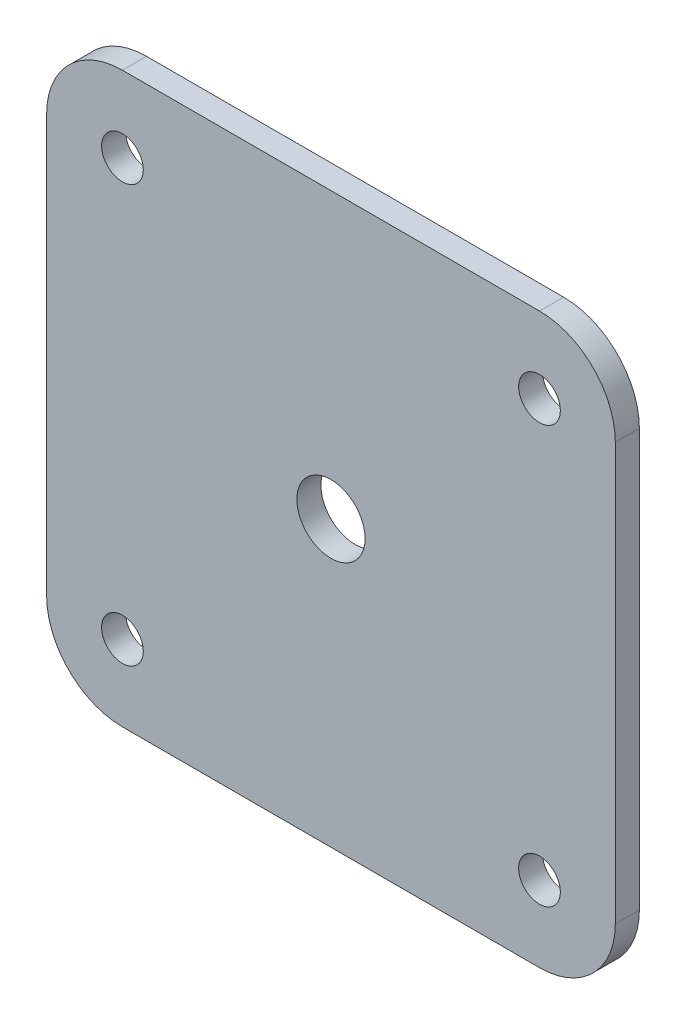
from build123d import *

# Parameters (mm, degrees)
SKETCH1_W            = 75
SKETCH1_H            = 75
BOSS_EXTRUDE1_DEPTH  = 3.175
M8_CLEARANCE_HOLE1_D = 9
M5_CLEARANCE_HOLE1_D = 5.5
FILLET1_R            = 10


with BuildPart() as part:
    # Sketch1 → Boss-Extrude1 (new body)
    with BuildSketch(Plane.XY.offset(107.95)):
        with Locations((0, 279.4)):
            Rectangle(SKETCH1_W, SKETCH1_H)
    extrude(amount=BOSS_EXTRUDE1_DEPTH)

    # M8 Clearance Hole1 (through all)
    with Locations(Plane.XY.offset(111.125)):
        with Locations((0, 279.4)):
            Hole(M8_CLEARANCE_HOLE1_D / 2)

    # M5 Clearance Hole1 (through all)
    with Locations(Plane.XY.offset(111.125)):
        with Locations((-27.5, 306.9), (27.5, 306.9), (27.5, 251.9), (-27.5, 251.9)):
            Hole(M5_CLEARANCE_HOLE1_D / 2)

    # Fillet1
    fillet1_edges = [part.edges().sort_by_distance(p)[0] for p in [
        (37.5, 241.9, 109.5375),
        (-37.5, 241.9, 109.5375),
        (-37.5, 316.9, 109.5375),
        (37.5, 316.9, 109.5375),
    ]]
    fillet(fillet1_edges, radius=FILLET1_R)


solid = part.part
